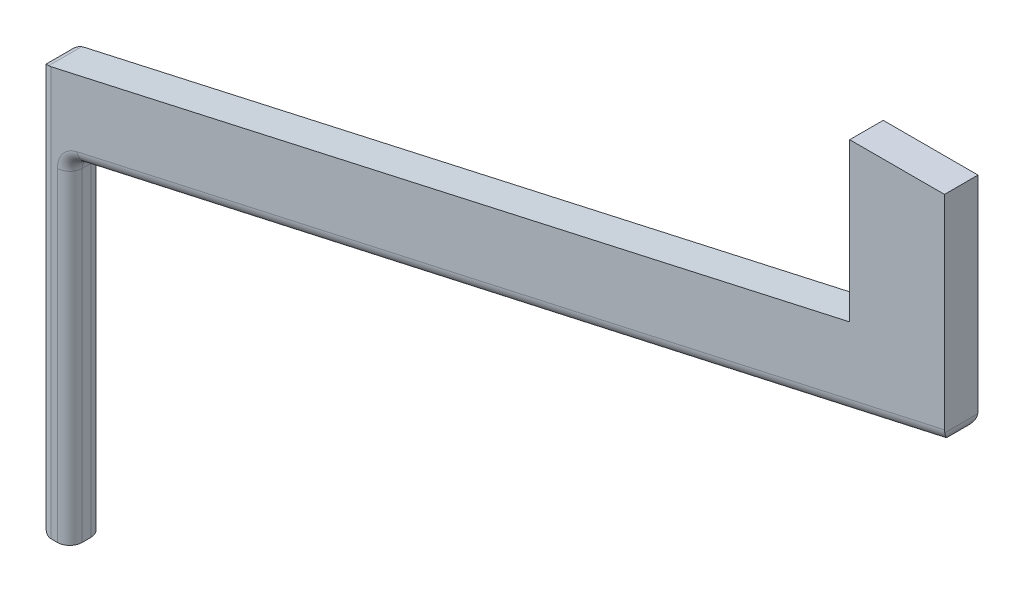
from build123d import *

# Parameters (mm, degrees)
RESSALTO_EXTRUS_O1_DEPTH = 0.27
FILETE5_R                = 0.1


with BuildPart() as part:
    # Esboço1 → Ressalto-extrusão1 (new body)
    with BuildSketch(Plane.XY):
        Polygon((0, 0), (0, 3.270833333), (6.53125, 4.729166667), (6.53125, 6), (7.294533781, 6), (7.294533781, 4.255670993), (6.629245544, 4.107740982), (0.25, 2.689285325), (0.25, 0), align=None)
    extrude(amount=RESSALTO_EXTRUS_O1_DEPTH)

    # Filete5
    filete5_edges = [part.edges().sort_by_distance(p)[0] for p in [
        (3.772266891, 3.472478159, 0.27),
        (3.772266891, 3.472478159, 0),
        (0.25, 1.344642663, 0),
        (0, 0, 0.135),
        (0, 3.270833333, 0.135),
        (7.294533781, 4.255670993, 0.135),
        (0.25, 2.689285325, 0.135),
        (0, 1.635416667, 0.27),
        (0.25, 1.344642663, 0.27),
        (0, 1.635416667, 0),
    ]]
    fillet(filete5_edges, radius=FILETE5_R)


solid = part.part
